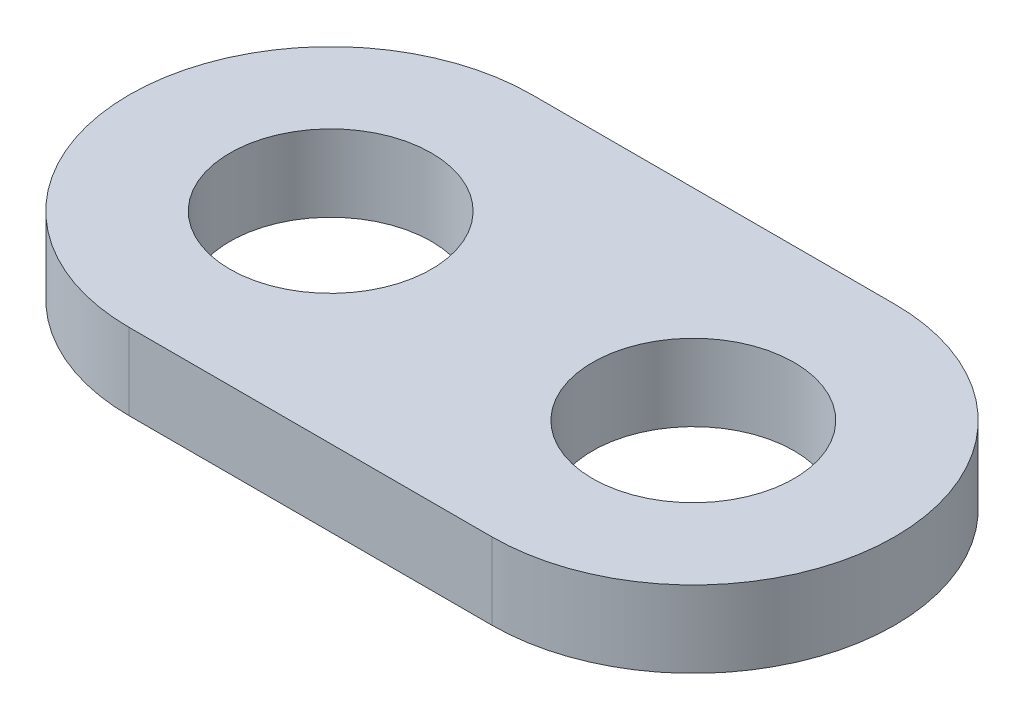
from build123d import *

# Parameters (mm, degrees)
SKETCH1_R           = 3.175
BOSS_EXTRUDE1_DEPTH = 2.413


with BuildPart() as part:
    # Sketch1 → Boss-Extrude1 (new body)
    with BuildSketch(Plane(origin=(0, 0, 0), x_dir=(1, 0, 0), z_dir=(0, 1, 0))):
        with BuildLine():
            Line((0, 6.35), (11.43, 6.35))
            ThreePointArc((11.43, 6.35), (17.78, 0), (11.43, -6.35))
            Line((11.43, -6.35), (0, -6.35))
            ThreePointArc((0, -6.35), (-6.35, 0), (0, 6.35))
        make_face()
        with Locations(Location((0, 0, 0), (0, 0, 270))):
            Circle(SKETCH1_R, mode=Mode.SUBTRACT)
        with Locations(Location((11.43, 0, 0), (0, 0, 270))):
            Circle(SKETCH1_R, mode=Mode.SUBTRACT)
    extrude(amount=BOSS_EXTRUDE1_DEPTH)


solid = part.part
